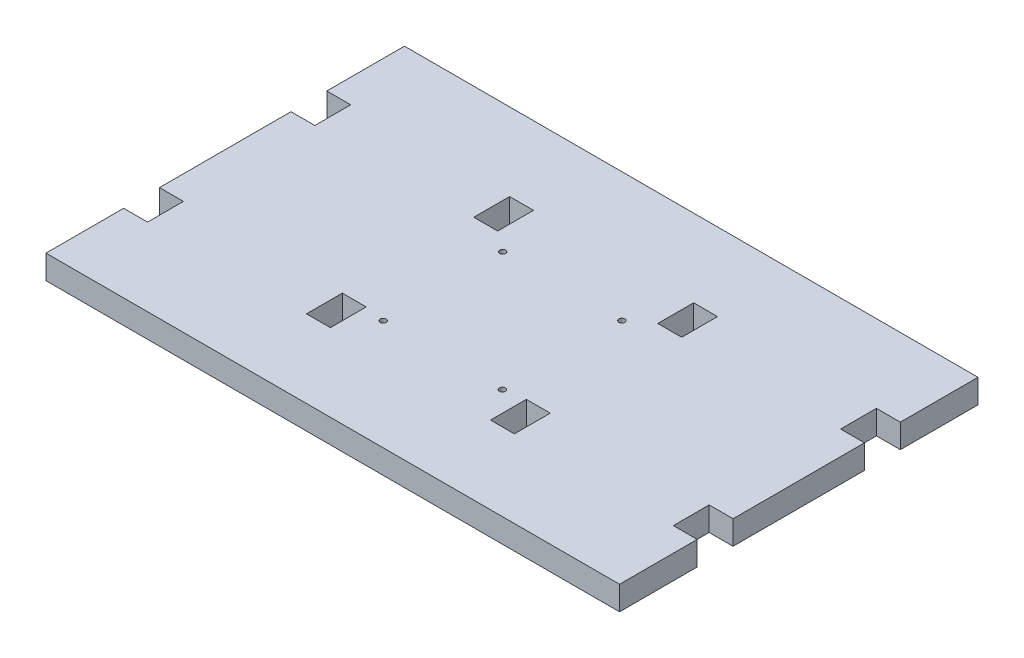
from build123d import *

# Parameters (mm, degrees)
SKETCH1_W          = 304.8
SKETCH1_H          = 190.5
EXTRUDE1_DEPTH     = 12.7
SKETCH2_W          = 12.7
SKETCH2_H          = 19.05
EXTRUDE2_DEPTH     = 181.165514181
SKETCH3_R          = 1.5875
CUT_EXTRUDE1_DEPTH = 181.165514181


with BuildPart() as part:
    # Sketch1 → Extrude1 (new body)
    with BuildSketch(Plane(origin=(0, 0, 0), x_dir=(1, 0, 0), z_dir=(0, 1, 0))):
        Rectangle(SKETCH1_W, SKETCH1_H)
    extrude(amount=EXTRUDE1_DEPTH)

    # Sketch2 → Extrude2 (cut, through all)
    with BuildSketch(Plane(origin=(0, 12.7, 0), x_dir=(1, 0, 0), z_dir=(0, 1, 0))):
        with Locations((-48.895, 44.45)):
            Rectangle(SKETCH2_W, SKETCH2_H)
        with Locations((48.895, 44.45)):
            Rectangle(SKETCH2_W, SKETCH2_H)
        with Locations((-48.895, -44.45)):
            Rectangle(SKETCH2_W, SKETCH2_H)
        with Locations((48.895, -44.45)):
            Rectangle(SKETCH2_W, SKETCH2_H)
        with Locations((146.05, 44.45)):
            Rectangle(SKETCH2_W, SKETCH2_H)
        with Locations((-146.05, 44.45)):
            Rectangle(SKETCH2_W, SKETCH2_H)
        with Locations((146.05, -44.45)):
            Rectangle(SKETCH2_W, SKETCH2_H)
        with Locations((-146.05, -44.45)):
            Rectangle(SKETCH2_W, SKETCH2_H)
    extrude(amount=-EXTRUDE2_DEPTH, mode=Mode.SUBTRACT)

    # Sketch3 → Cut-Extrude1 (cut, through all)
    with BuildSketch(Plane.XZ):
        with Locations(Location((31.6865, 36.796180661, 0), (0, 0, 270))):
            Circle(SKETCH3_R)
        with Locations(Location((31.6865, -26.703819339, 0), (0, 0, 270))):
            Circle(SKETCH3_R)
        with Locations(Location((-31.6865, -26.703819339, 0), (0, 0, 90))):
            Circle(SKETCH3_R)
        with Locations(Location((-31.6865, 36.796180661, 0), (0, 0, 90))):
            Circle(SKETCH3_R)
    extrude(amount=-CUT_EXTRUDE1_DEPTH, mode=Mode.SUBTRACT)


solid = part.part
